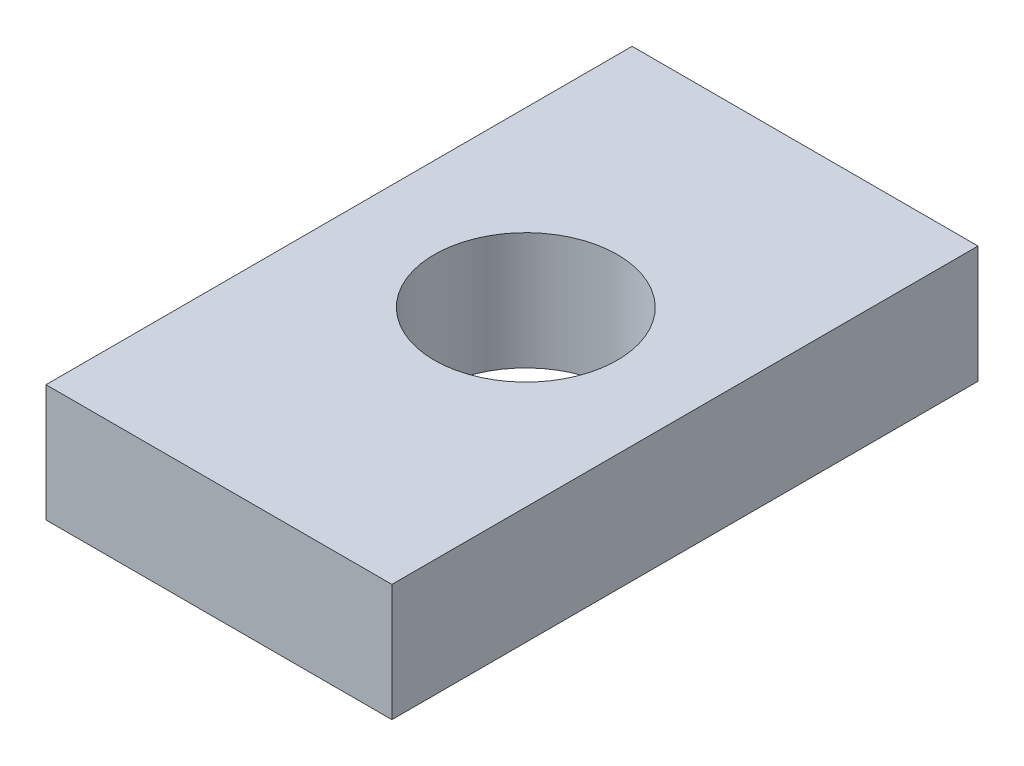
from build123d import *

# Parameters (mm, degrees)
SKETCH1_W               = 29.520850198
SKETCH1_H               = 50.018346185
BOSS_EXTRUDE1_DEPTH     = 10
CUT_EXTRUDE1_DEPTH      = 59.934841575
CUT_EXTRUDE1_DEPTH_BACK = 59.934841575
SKETCH2_R               = 7.812618591


with BuildPart() as part:
    # Sketch1 → Boss-Extrude1 (new body)
    with BuildSketch(Plane(origin=(0, 0, 0), x_dir=(1, 0, 0), z_dir=(0, 1, 0))):
        with Locations((14.760425099, 25.009173093)):
            Rectangle(SKETCH1_W, SKETCH1_H)
    extrude(amount=BOSS_EXTRUDE1_DEPTH)

    # Sketch2 → Cut-Extrude1 (cut, two sides: drawn at the far end of the back side and taken through both)
    with BuildSketch(Plane(origin=(0, 10, 0), x_dir=(1, 0, 0), z_dir=(0, 1, 0)).offset(-CUT_EXTRUDE1_DEPTH_BACK)):
        with Locations(Location((14.760425099, 26.187461577, 0), (0, 0, 270))):
            Circle(SKETCH2_R)
    extrude(amount=CUT_EXTRUDE1_DEPTH + CUT_EXTRUDE1_DEPTH_BACK, mode=Mode.SUBTRACT)


solid = part.part
